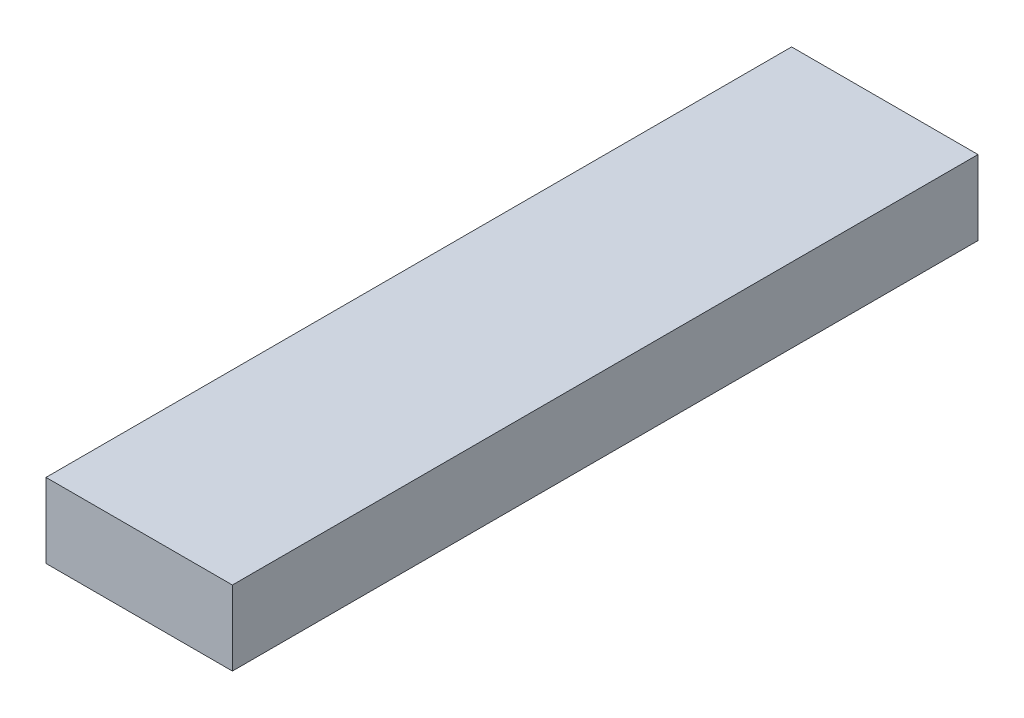
from build123d import *

# Parameters (mm, degrees)
SKETCH1_W           = 2.5
SKETCH1_H           = 10
BOSS_EXTRUDE1_DEPTH = 1


with BuildPart() as part:
    # Sketch1 → Boss-Extrude1 (new body)
    with BuildSketch(Plane(origin=(0, 0, 0), x_dir=(1, 0, 0), z_dir=(0, 1, 0))):
        with Locations((1.25, 5)):
            Rectangle(SKETCH1_W, SKETCH1_H)
    extrude(amount=BOSS_EXTRUDE1_DEPTH)


solid = part.part
